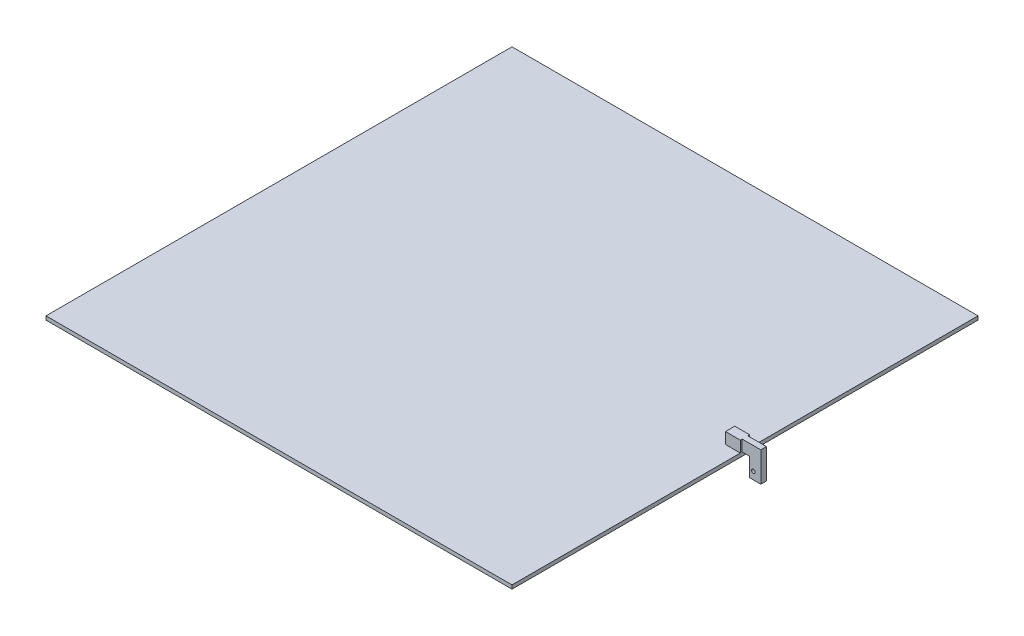
from build123d import *

# Parameters (mm, degrees)
CROQUIS1_W              = 250
CROQUIS1_H              = 250
SALIENTE_EXTRUIR1_DEPTH = 2
CROQUIS2_W              = 8
CROQUIS2_H              = 5
SALIENTE_EXTRUIR2_DEPTH = 6
CROQUIS3_W              = 5
CROQUIS3_H              = 6
SALIENTE_EXTRUIR3_DEPTH = 10
CROQUIS4_W              = 6
CROQUIS4_H              = 5
SALIENTE_EXTRUIR4_DEPTH = 10
CORTAR_EXTRUIR1_REACH   = 187.864
CROQUIS5_R              = 0.983022383
CORTAR_EXTRUIR2_REACH   = 186.678
CROQUIS6_W              = 10
CROQUIS6_H              = 1


with BuildPart() as part:
    # Croquis1 → Saliente-Extruir1 (new body)
    with BuildSketch(Plane(origin=(0, 0, 0), x_dir=(1, 0, 0), z_dir=(0, 1, 0))):
        Rectangle(CROQUIS1_W, CROQUIS1_H)
    extrude(amount=SALIENTE_EXTRUIR1_DEPTH)

    # Croquis2 → Saliente-Extruir2 (add)
    with BuildSketch(Plane(origin=(0, 2, 0), x_dir=(1, 0, 0), z_dir=(0, 1, 0))):
        with Locations((121, 0)):
            Rectangle(CROQUIS2_W, CROQUIS2_H)
    extrude(amount=SALIENTE_EXTRUIR2_DEPTH)

    # Croquis3 → Saliente-Extruir3 (add)
    with BuildSketch(Plane(origin=(125, 0, 0), x_dir=(0, 0, -1), z_dir=(1, 0, 0))):
        with Locations((0, 5)):
            Rectangle(CROQUIS3_W, CROQUIS3_H)
    extrude(amount=SALIENTE_EXTRUIR3_DEPTH)

    # Croquis4 → Saliente-Extruir4 (add)
    with BuildSketch(Plane.XZ.offset(-2)):
        with Locations((132, 0)):
            Rectangle(CROQUIS4_W, CROQUIS4_H)
    extrude(amount=SALIENTE_EXTRUIR4_DEPTH)

    # Croquis5 → Cortar-Extruir1 (cut, up to next)
    with BuildSketch(Plane(origin=(0, 0, -2.5), x_dir=(-1, 0, 0), z_dir=(0, 0, -1)), mode=Mode.PRIVATE) as cortar_extruir1_sk1:
        with Locations((-131, -4)):
            Circle(CROQUIS5_R)
    cortar_extruir1_tool1 = extrude(cortar_extruir1_sk1.sketch, amount=-CORTAR_EXTRUIR1_REACH, mode=Mode.PRIVATE) & part.part
    add(cortar_extruir1_tool1.solids().sort_by_distance((131, -4, -2.5))[0], mode=Mode.SUBTRACT)

    # Croquis6 → Cortar-Extruir2 (cut, up to next)
    with BuildSketch(Plane(origin=(0, 8, 0), x_dir=(1, 0, 0), z_dir=(0, 1, 0)), mode=Mode.PRIVATE) as cortar_extruir2_sk1:
        with Locations((130, -2)):
            Rectangle(CROQUIS6_W, CROQUIS6_H)
    cortar_extruir2_tool1 = extrude(cortar_extruir2_sk1.sketch, amount=-CORTAR_EXTRUIR2_REACH, mode=Mode.PRIVATE) & part.part
    # Croquis6 → Cortar-Extruir2 (cut, up to next)
    with BuildSketch(Plane(origin=(0, 8, 0), x_dir=(1, 0, 0), z_dir=(0, 1, 0)), mode=Mode.PRIVATE) as cortar_extruir2_sk2:
        with Locations((130, 2)):
            Rectangle(CROQUIS6_W, CROQUIS6_H)
    cortar_extruir2_tool2 = extrude(cortar_extruir2_sk2.sketch, amount=-CORTAR_EXTRUIR2_REACH, mode=Mode.PRIVATE) & part.part
    add(cortar_extruir2_tool1.solids().sort_by_distance((130, 8, 2))[0], mode=Mode.SUBTRACT)
    add(cortar_extruir2_tool2.solids().sort_by_distance((130, 8, -2))[0], mode=Mode.SUBTRACT)


solid = part.part
